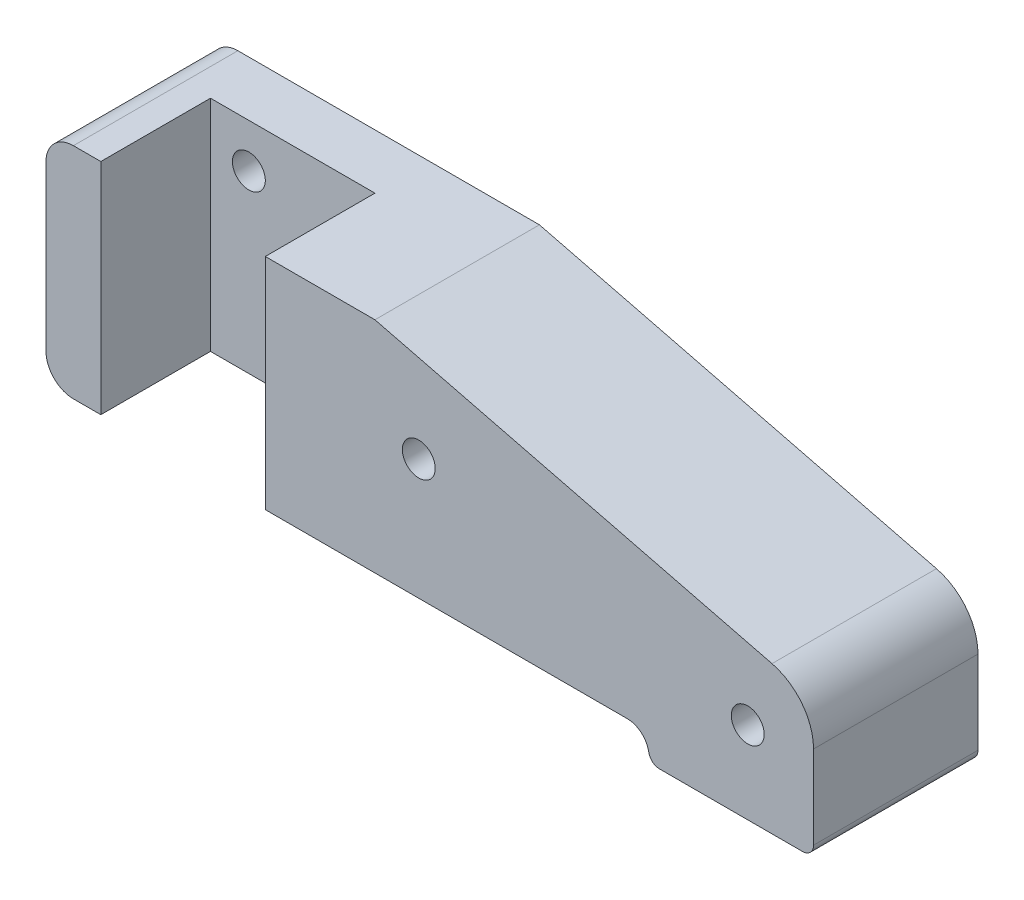
from build123d import *

# Parameters (mm, degrees)
ESQUISSE1_W                  = 140
ESQUISSE1_H                  = 40
BOSS_EXTRU_1_DEPTH           = 30
ESQUISSE2_W                  = 30
ESQUISSE2_H                  = 40
ENL_V_MAT_EXTRU_1_DEPTH      = 20
ENL_V_MAT_EXTRU_2_DEPTH      = 149.660687473
ENL_V_MAT_EXTRU_2_DEPTH_BACK = 149.660687473
ENL_V_MAT_EXTRU_6_DEPTH      = 149.660687473
ENL_V_MAT_EXTRU_6_DEPTH_BACK = 149.660687473
ESQUISSE5_R                  = 3
CONG_1_R                     = 10
ESQUISSE6_W                  = 30
ESQUISSE6_H                  = 5
BOSS_EXTRU_2_DEPTH           = 30
CONG_2_R                     = 4
CONG_3_R                     = 2
CONG_4_R                     = 5


with BuildPart() as part:
    # Esquisse1 → Boss.-Extru.1 (new body)
    with BuildSketch(Plane.XY):
        with Locations((70, 20)):
            Rectangle(ESQUISSE1_W, ESQUISSE1_H)
    extrude(amount=BOSS_EXTRU_1_DEPTH)

    # Esquisse2 → Enlèv. mat.-Extru.1 (cut)
    with BuildSketch(Plane.XY.offset(30)):
        with Locations((25, 20)):
            Rectangle(ESQUISSE2_W, ESQUISSE2_H)
    extrude(amount=-ENL_V_MAT_EXTRU_1_DEPTH, mode=Mode.SUBTRACT)

    # Esquisse3 → Enlèv. mat.-Extru.2 (cut, two sides: drawn at the far end of the back side and taken through both)
    with BuildSketch(Plane.XY.offset(30).offset(-ENL_V_MAT_EXTRU_2_DEPTH_BACK)):
        Polygon((140, 20), (60, 40), (140, 40), align=None)
    extrude(amount=ENL_V_MAT_EXTRU_2_DEPTH + ENL_V_MAT_EXTRU_2_DEPTH_BACK, mode=Mode.SUBTRACT)

    # Esquisse5 → Enlèv. mat.-Extru.6 (cut, two sides: drawn at the far end of the back side and taken through both)
    with BuildSketch(Plane.XY.offset(30).offset(-ENL_V_MAT_EXTRU_6_DEPTH_BACK)):
        with Locations(Location((17, 32, 0), (0, 0, 180))):
            Circle(ESQUISSE5_R)
        with Locations(Location((33, 8, 0), (0, 0, 180))):
            Circle(ESQUISSE5_R)
        with Locations(Location((68, 22, 0), (0, 0, 180))):
            Circle(ESQUISSE5_R)
        with Locations(Location((128, 10, 0), (0, 0, 180))):
            Circle(ESQUISSE5_R)
    extrude(amount=ENL_V_MAT_EXTRU_6_DEPTH + ENL_V_MAT_EXTRU_6_DEPTH_BACK, mode=Mode.SUBTRACT)

    # Congé1
    cong_1_edges = [part.edges().sort_by_distance(p)[0] for p in [
        (140, 20, 15),
    ]]
    fillet(cong_1_edges, radius=CONG_1_R)

    # Esquisse6 → Boss.-Extru.2 (add)
    with BuildSketch(Plane.XY.offset(30)):
        with Locations((125, -2.5)):
            Rectangle(ESQUISSE6_W, ESQUISSE6_H)
    extrude(amount=-BOSS_EXTRU_2_DEPTH)

    # Congé2
    cong_2_edges = [part.edges().sort_by_distance(p)[0] for p in [
        (110, 0, 15),
    ]]
    fillet(cong_2_edges, radius=CONG_2_R)

    # Congé3
    cong_3_edges = [part.edges().sort_by_distance(p)[0] for p in [
        (140, -5, 15),
        (110, -5, 15),
    ]]
    fillet(cong_3_edges, radius=CONG_3_R)

    # Congé4
    cong_4_edges = [part.edges().sort_by_distance(p)[0] for p in [
        (0, 40, 15),
        (0, 0, 15),
    ]]
    fillet(cong_4_edges, radius=CONG_4_R)


solid = part.part
